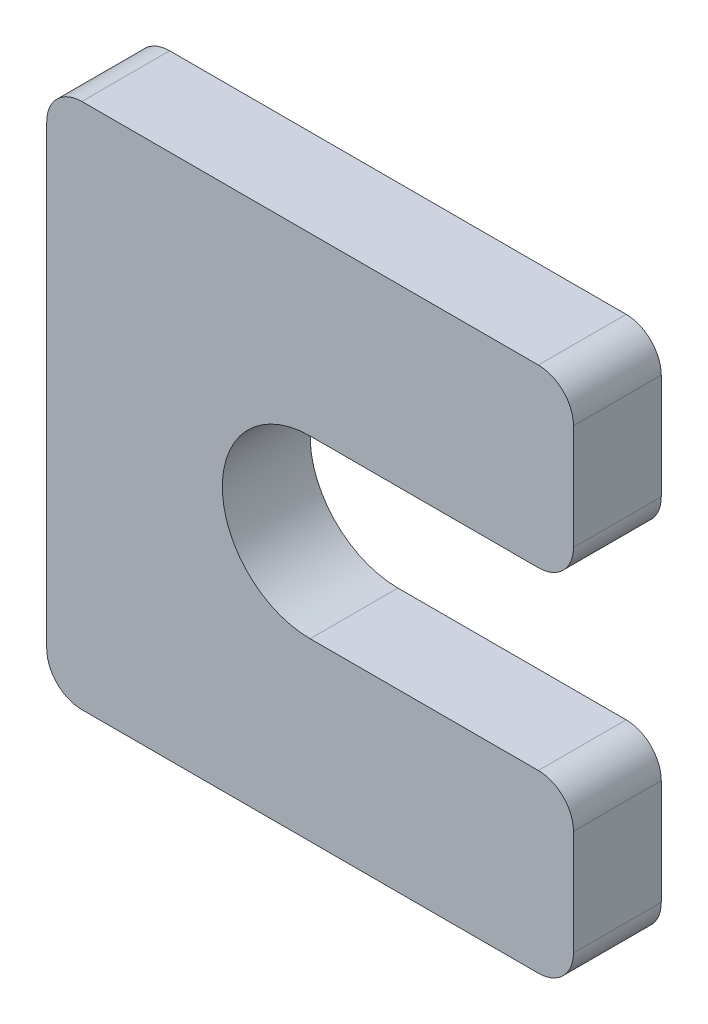
from build123d import *

# Parameters (mm, degrees)
ESQUISSE1_W                  = 30
ESQUISSE1_H                  = 30
BOSS_EXTRU_1_DEPTH           = 5
ENL_V_MAT_EXTRU_1_DEPTH      = 43.720018727
ENL_V_MAT_EXTRU_1_DEPTH_BACK = 43.720018727
ESQUISSE2_R                  = 5
ENL_V_MAT_EXTRU_2_DEPTH      = 43.720018727
ENL_V_MAT_EXTRU_2_DEPTH_BACK = 43.720018727
ESQUISSE3_W                  = 15
ESQUISSE3_H                  = 10
CONG_1_R                     = 2


with BuildPart() as part:
    # Esquisse1 → Boss.-Extru.1 (new body)
    with BuildSketch(Plane.XY):
        with Locations((15, 15)):
            Rectangle(ESQUISSE1_W, ESQUISSE1_H)
    extrude(amount=BOSS_EXTRU_1_DEPTH)

    # Esquisse2 → Enlèv. mat.-Extru.1 (cut, two sides: drawn at the far end of the back side and taken through both)
    with BuildSketch(Plane.XY.offset(5).offset(-ENL_V_MAT_EXTRU_1_DEPTH_BACK)):
        with Locations((15, 15)):
            Circle(ESQUISSE2_R)
    extrude(amount=ENL_V_MAT_EXTRU_1_DEPTH + ENL_V_MAT_EXTRU_1_DEPTH_BACK, mode=Mode.SUBTRACT)

    # Esquisse3 → Enlèv. mat.-Extru.2 (cut, two sides: drawn at the far end of the back side and taken through both)
    with BuildSketch(Plane.XY.offset(5).offset(-ENL_V_MAT_EXTRU_2_DEPTH_BACK)):
        with Locations((22.5, 15)):
            Rectangle(ESQUISSE3_W, ESQUISSE3_H)
    extrude(amount=ENL_V_MAT_EXTRU_2_DEPTH + ENL_V_MAT_EXTRU_2_DEPTH_BACK, mode=Mode.SUBTRACT)

    # Congé1
    cong_1_edges = [part.edges().sort_by_distance(p)[0] for p in [
        (30, 10, 2.5),
        (30, 20, 2.5),
        (30, 30, 2.5),
        (30, 0, 2.5),
        (0, 0, 2.5),
        (0, 30, 2.5),
    ]]
    fillet(cong_1_edges, radius=CONG_1_R)


solid = part.part
